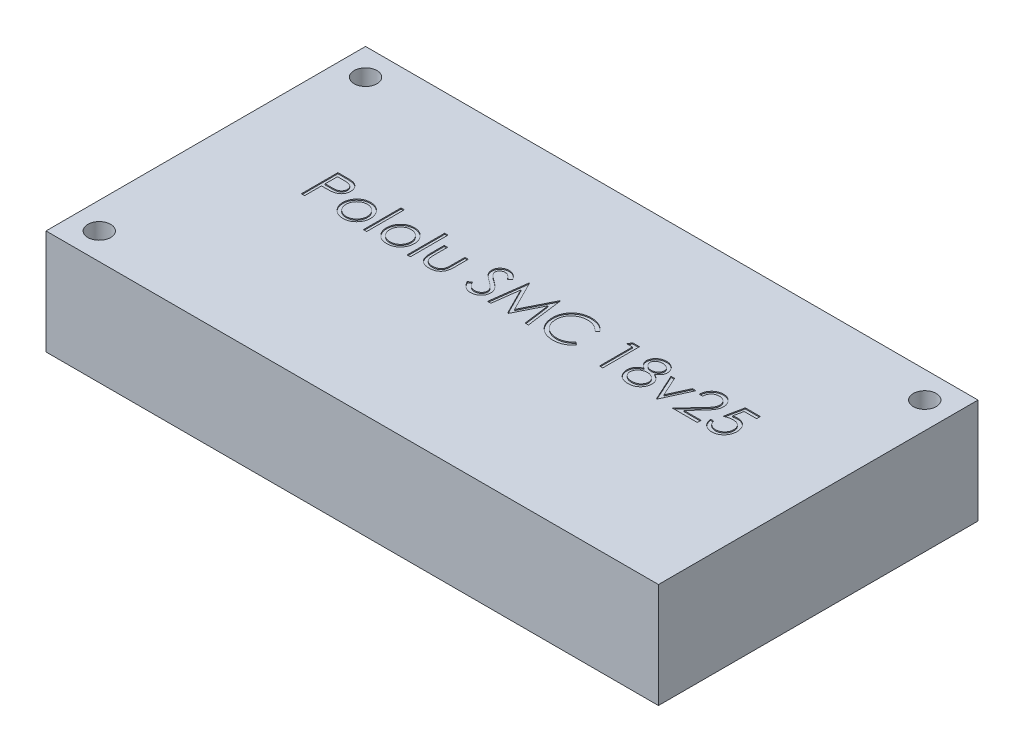
from build123d import *

# Parameters (mm, degrees)
SKETCH1_W           = 58.42
SKETCH1_H           = 30.48
BOSS_EXTRUDE1_DEPTH = 10
SKETCH2_R           = 1.0922
CUT_EXTRUDE1_DEPTH  = 35.430824852
SKETCH3_W           = 0.314102564
SKETCH3_H           = 3.58974359
CUT_EXTRUDE2_DEPTH  = 0.1


with BuildPart() as part:
    # Sketch1 → Boss-Extrude1 (new body)
    with BuildSketch(Plane(origin=(0, 0, 0), x_dir=(1, 0, 0), z_dir=(0, 1, 0))):
        Rectangle(SKETCH1_W, SKETCH1_H)
    extrude(amount=BOSS_EXTRUDE1_DEPTH)

    # Sketch2 → Cut-Extrude1 (cut, through all)
    with BuildSketch(Plane(origin=(0, 10, 0), x_dir=(1, 0, 0), z_dir=(0, 1, 0))):
        with Locations(Location((-26.67, 12.7, 0), (0, 0, 270))):
            Circle(SKETCH2_R)
        with Locations(Location((-26.67, -12.7, 0), (0, 0, 270))):
            Circle(SKETCH2_R)
        with Locations(Location((26.67, 12.7, 0), (0, 0, 270))):
            Circle(SKETCH2_R)
    extrude(amount=-CUT_EXTRUDE1_DEPTH, mode=Mode.SUBTRACT)

    # Sketch3 → Cut-Extrude2 (cut)
    # profile 1 of 14: a face of its own
    with BuildSketch(Plane(origin=(0, 10, 0), x_dir=(1, 0, 0), z_dir=(0, 1, 0))):
        with BuildLine():
            Line((-20.102564103, 3.5), (-19.416165865, 3.5))
            add(Edge.make_bspline(
                [(-19.416165865, 3.5), (-19.368954959, 3.499948104), (-19.278496766, 3.499848668), (-19.148781711, 3.496833922), (-19.030971979, 3.49280723), (-18.925321598, 3.487225337), (-18.8315055, 3.480628747), (-18.749948201, 3.471376708), (-18.680008644, 3.461716412), (-18.638102195, 3.451895005), (-18.618990385, 3.447415865)],
                knots=[0, 0, 0, 0, 1.415646017, 2.712440637, 3.8905458, 4.950247383, 5.884950622, 6.709939814, 7.411656543, 8, 8, 8, 8], degree=3))
            add(Edge.make_bspline(
                [(-18.618990385, 3.447415865), (-18.594796851, 3.440793916), (-18.546979874, 3.427706054), (-18.478078831, 3.40149233), (-18.412524985, 3.370410165), (-18.350093427, 3.334986225), (-18.291551344, 3.293700661), (-18.236025303, 3.248227043), (-18.184005322, 3.197515475), (-18.13578393, 3.142134735), (-18.091499133, 3.083014525), (-18.05336945, 3.019272295), (-18.021442223, 2.951980992), (-17.994058952, 2.881187421), (-17.974350497, 2.806297097), (-17.959503597, 2.727830385), (-17.95007997, 2.645795695), (-17.949177408, 2.589735827), (-17.948717949, 2.561197917)],
                knots=[0, 0, 0, 0, 0.999701418, 1.975846123, 2.934577507, 3.890451536, 4.834027766, 5.787354733, 6.749476667, 7.726910423, 8.712836071, 9.690891519, 10.682875813, 11.679750201, 12.712814741, 13.765529915, 14.8625177, 16, 16, 16, 16], degree=3))
            add(Edge.make_bspline(
                [(-17.948717949, 2.561197917), (-17.949139373, 2.53242014), (-17.949963919, 2.476114476), (-17.959860205, 2.393741688), (-17.973190396, 2.315023298), (-17.993687449, 2.240133847), (-18.020533122, 2.169518077), (-18.052025175, 2.102096845), (-18.090008705, 2.039017173), (-18.133653535, 1.980050055), (-18.182205129, 1.925140143), (-18.235458067, 1.874685348), (-18.29319736, 1.82898101), (-18.355239508, 1.787924666), (-18.422189357, 1.752468387), (-18.49303151, 1.720711082), (-18.568381727, 1.694040021), (-18.620524241, 1.68000996), (-18.647035256, 1.672876603)],
                knots=[0, 0, 0, 0, 1.121902311, 2.195077645, 3.232258892, 4.234102512, 5.217864754, 6.176164875, 7.132989551, 8.084763148, 9.034132444, 9.988522005, 10.94243251, 11.903244335, 12.886203696, 13.894208494, 14.929344452, 16, 16, 16, 16], degree=3))
            add(Edge.make_bspline(
                [(-18.647035256, 1.672876603), (-18.66896259, 1.668213621), (-18.717017618, 1.657994427), (-18.79616034, 1.64658597), (-18.888305726, 1.63684837), (-18.993328006, 1.629547232), (-19.111132911, 1.623296864), (-19.241784168, 1.61832877), (-19.385538245, 1.615598916), (-19.485809489, 1.615458123), (-19.538161058, 1.615384615)],
                knots=[0, 0, 0, 0, 0.601384939, 1.31797006, 2.144135048, 3.087295005, 4.142315834, 5.309527816, 6.595305764, 8, 8, 8, 8], degree=3))
            Line((-19.538161058, 1.615384615), (-19.788461538, 1.615384615))
            Line((-19.788461538, 1.615384615), (-19.788461538, 0))
            Line((-19.788461538, 0), (-20.102564103, 0))
            Line((-20.102564103, 0), (-20.102564103, 3.5))
        make_face()
        with BuildLine():
            Line((-19.788461538, 3.141025641), (-19.788461538, 1.974358974))
            Line((-19.788461538, 1.974358974), (-19.17568109, 1.966646635))
            add(Edge.make_bspline(
                [(-19.17568109, 1.966646635), (-19.145761164, 1.966631171), (-19.088001364, 1.966601319), (-19.004565141, 1.970586542), (-18.927155853, 1.975187075), (-18.856011278, 1.981922998), (-18.791099344, 1.991444256), (-18.732311815, 2.001055994), (-18.680104532, 2.014961356), (-18.61900533, 2.033684426), (-18.550921983, 2.065617041), (-18.476854434, 2.111966931), (-18.414083848, 2.17104764), (-18.359765551, 2.237475471), (-18.316659673, 2.3113746), (-18.285103681, 2.390443537), (-18.266562523, 2.473871387), (-18.26407633, 2.530959525), (-18.262820513, 2.559795673)],
                knots=[0, 0, 0, 0, 1.160613943, 2.240541288, 3.23993089, 4.169200891, 5.011653406, 5.7853311, 6.478053781, 7.106038997, 8.262395093, 9.384106736, 10.481365981, 11.59014053, 12.70357646, 13.786202915, 14.881775077, 16, 16, 16, 16], degree=3))
            add(Edge.make_bspline(
                [(-18.262820513, 2.559795673), (-18.264083159, 2.587934187), (-18.266593144, 2.643870069), (-18.285249007, 2.725848829), (-18.316598321, 2.804084534), (-18.360054916, 2.877057619), (-18.412796046, 2.943246423), (-18.474095389, 3.00074355), (-18.54380865, 3.046965253), (-18.608656881, 3.076798534), (-18.666258067, 3.09501381), (-18.716290027, 3.10775865), (-18.772780702, 3.117934257), (-18.835748481, 3.126173759), (-18.904705315, 3.133227221), (-18.98024363, 3.138013198), (-19.062077273, 3.140814654), (-19.118887844, 3.140953609), (-19.14833734, 3.141025641)],
                knots=[0, 0, 0, 0, 1.120700087, 2.227813068, 3.331159281, 4.466773991, 5.599788987, 6.693661531, 7.80175334, 8.91857717, 9.525282508, 10.207424825, 10.974604443, 11.810962634, 12.737642355, 13.736264703, 14.826523623, 16, 16, 16, 16], degree=3))
            Line((-19.14833734, 3.141025641), (-19.788461538, 3.141025641))
        make_face(mode=Mode.SUBTRACT)
    # profile 2 of 14: a face of its own
    with BuildSketch(Plane(origin=(0, 10, 0), x_dir=(1, 0, 0), z_dir=(0, 1, 0))):
        with BuildLine():
            add(Edge.make_bspline(
                [(-16.085136218, 2.602564103), (-16.037144945, 2.601542211), (-15.943045788, 2.599538533), (-15.805237902, 2.578123567), (-15.673692766, 2.545376203), (-15.547906574, 2.500104641), (-15.429490278, 2.43942269), (-15.316719034, 2.367013399), (-15.209902025, 2.281230805), (-15.145878996, 2.214872737), (-15.11338141, 2.181189904)],
                knots=[0, 0, 0, 0, 1.054011418, 2.066658804, 3.057071809, 4.030435133, 4.997543892, 5.974964718, 6.972108034, 8, 8, 8, 8], degree=3))
            add(Edge.make_bspline(
                [(-15.11338141, 2.181189904), (-15.085399456, 2.148975918), (-15.029977076, 2.085171376), (-14.958911357, 1.981715763), (-14.897689797, 1.874575662), (-14.848626836, 1.762328336), (-14.809941812, 1.645953664), (-14.782476116, 1.525051653), (-14.766139181, 1.399889306), (-14.763936214, 1.314885468), (-14.762820513, 1.271834936)],
                knots=[0, 0, 0, 0, 1.025258237, 2.030674902, 3.01204498, 3.988269485, 4.97094183, 5.956517959, 6.965070386, 8, 8, 8, 8], degree=3))
            add(Edge.make_bspline(
                [(-14.762820513, 1.271834936), (-14.76380185, 1.228534878), (-14.765741018, 1.142971945), (-14.784084635, 1.016952579), (-14.812615721, 0.894757756), (-14.853447559, 0.776899063), (-14.905805668, 0.663016235), (-14.969696356, 0.553606686), (-15.045567973, 0.448454553), (-15.13157197, 0.348452714), (-15.226623846, 0.2562865), (-15.329739994, 0.17595823), (-15.438894028, 0.107136706), (-15.555537381, 0.05170029), (-15.678604868, 0.00799059), (-15.808361936, -0.022709427), (-15.944607006, -0.04127111), (-16.037634228, -0.043654684), (-16.085136218, -0.044871795)],
                knots=[0, 0, 0, 0, 0.998656419, 1.973391657, 2.932242238, 3.890759089, 4.846373663, 5.82037756, 6.809684879, 7.83454468, 8.860553229, 9.859544525, 10.845671541, 11.83227036, 12.833544569, 13.85385346, 14.904124723, 16, 16, 16, 16], degree=3))
            add(Edge.make_bspline(
                [(-16.085136218, -0.044871795), (-16.132870937, -0.043650599), (-16.226361797, -0.041258824), (-16.363087779, -0.022781541), (-16.493077398, 0.007976441), (-16.616305997, 0.051843934), (-16.733450844, 0.107138478), (-16.84323734, 0.175750167), (-16.946437256, 0.256310322), (-17.04150924, 0.348446259), (-17.127507846, 0.448456216), (-17.203380854, 0.553606254), (-17.26727118, 0.663016348), (-17.319629384, 0.776899033), (-17.360461197, 0.894757764), (-17.38899229, 1.016952577), (-17.407335904, 1.142971945), (-17.409275073, 1.228534878), (-17.41025641, 1.271834936)],
                knots=[0, 0, 0, 0, 1.099876186, 2.154163076, 3.173186993, 4.173200201, 5.163417411, 6.152872554, 7.150605724, 8.17532212, 9.198891216, 10.186952605, 11.159729845, 12.11414092, 13.071450619, 14.029093627, 15.002601286, 16, 16, 16, 16], degree=3))
            add(Edge.make_bspline(
                [(-17.41025641, 1.271834936), (-17.4091331, 1.314651482), (-17.406909138, 1.399420884), (-17.390588629, 1.524347945), (-17.363230073, 1.645045334), (-17.324498676, 1.76097081), (-17.274983486, 1.872726246), (-17.214622198, 1.980131077), (-17.142831565, 2.083118877), (-17.087629614, 2.146840957), (-17.059695513, 2.179086538)],
                knots=[0, 0, 0, 0, 1.031353054, 2.041901799, 3.029428768, 4.008703097, 4.981709435, 5.96992636, 6.972712378, 8, 8, 8, 8], degree=3))
            add(Edge.make_bspline(
                [(-17.059695513, 2.179086538), (-17.027246922, 2.213061478), (-16.963431058, 2.279879174), (-16.85608233, 2.365411698), (-16.743588509, 2.439327772), (-16.623863583, 2.498803987), (-16.498180725, 2.545642505), (-16.365961482, 2.57820802), (-16.227685967, 2.599461375), (-16.133126346, 2.601519553), (-16.085136218, 2.602564103)],
                knots=[0, 0, 0, 0, 1.027980169, 2.021703884, 2.998553061, 3.971491411, 4.943284454, 5.930300938, 6.949603206, 8, 8, 8, 8], degree=3))
        make_face()
        with BuildLine():
            add(Edge.make_bspline(
                [(-16.086538462, 2.288461538), (-16.120476073, 2.287496947), (-16.187475202, 2.285592664), (-16.286094786, 2.27110876), (-16.38103494, 2.248161255), (-16.472475784, 2.215557199), (-16.560108957, 2.1734583), (-16.644018359, 2.12174994), (-16.724450799, 2.061116984), (-16.799832862, 1.991654312), (-16.869015175, 1.915775317), (-16.929493151, 1.834926959), (-16.980918258, 1.750420612), (-17.023758416, 1.662168401), (-17.055665605, 1.569275987), (-17.078838627, 1.472795356), (-17.093308867, 1.37252994), (-17.095195246, 1.304368921), (-17.096153846, 1.269731571)],
                knots=[0, 0, 0, 0, 1.021534396, 2.016698045, 2.994645724, 3.958388632, 4.93408049, 5.916473867, 6.921342795, 7.962252576, 8.998418191, 10.008913653, 10.997312074, 11.973003931, 12.956656626, 13.948281152, 14.957379055, 16, 16, 16, 16], degree=3))
            add(Edge.make_bspline(
                [(-17.096153846, 1.269731571), (-17.094547023, 1.224979543), (-17.091357778, 1.136155138), (-17.065422542, 1.005344015), (-17.022036262, 0.879762163), (-16.963448982, 0.760145777), (-16.890042763, 0.649473499), (-16.803555697, 0.550802015), (-16.704915996, 0.465616203), (-16.595299496, 0.394935358), (-16.476945178, 0.338775602), (-16.351688857, 0.298976626), (-16.221048163, 0.273104934), (-16.131767432, 0.270533459), (-16.086538462, 0.269230769)],
                knots=[0, 0, 0, 0, 1.016792936, 2.018143844, 3.017858371, 4.030088057, 5.03801393, 6.028138512, 7.003788237, 7.991172063, 8.984598303, 9.972568034, 10.972917682, 12, 12, 12, 12], degree=3))
            add(Edge.make_bspline(
                [(-16.086538462, 0.269230769), (-16.041312093, 0.270541049), (-15.952036497, 0.273127506), (-15.82157732, 0.298846326), (-15.696663348, 0.338949987), (-15.57843196, 0.394872197), (-15.468865357, 0.465884611), (-15.369516236, 0.550320988), (-15.283767625, 0.64973484), (-15.21043402, 0.760292369), (-15.150887277, 0.879576721), (-15.107704075, 1.005367193), (-15.081706489, 1.136149235), (-15.078525661, 1.224977566), (-15.076923077, 1.269731571)],
                knots=[0, 0, 0, 0, 1.02726834, 2.027799167, 3.010890988, 4.004497153, 4.992059811, 5.971914811, 6.958719428, 7.966827853, 8.981595046, 9.981490638, 10.983022906, 12, 12, 12, 12], degree=3))
            add(Edge.make_bspline(
                [(-15.076923077, 1.269731571), (-15.077881347, 1.304369128), (-15.079767076, 1.372530554), (-15.09424204, 1.472793007), (-15.11739758, 1.569284604), (-15.149369197, 1.662136607), (-15.192023211, 1.750649112), (-15.244440004, 1.834678839), (-15.30467103, 1.916055385), (-15.374688151, 1.991409026), (-15.449991528, 2.061144062), (-15.530456567, 2.121773452), (-15.614241545, 2.173231047), (-15.701620128, 2.215917288), (-15.793072696, 2.247864628), (-15.887879825, 2.271241259), (-15.986078635, 2.285531456), (-16.052837678, 2.287478598), (-16.086538462, 2.288461538)],
                knots=[0, 0, 0, 0, 1.042956736, 2.052379634, 3.044323526, 4.02829302, 5.004299113, 5.996692471, 7.007513377, 8.048758398, 9.090003419, 10.095195979, 11.07790575, 12.047570684, 13.018257071, 13.989683339, 14.985167495, 16, 16, 16, 16], degree=3))
        make_face(mode=Mode.SUBTRACT)
    # profile 3 of 14: a face of its own
    with BuildSketch(Plane(origin=(0, 10, 0), x_dir=(1, 0, 0), z_dir=(0, 1, 0))):
        with Locations((-14.022435897, 1.794871795)):
            Rectangle(SKETCH3_W, SKETCH3_H)
    # profile 4 of 14: a face of its own
    with BuildSketch(Plane(origin=(0, 10, 0), x_dir=(1, 0, 0), z_dir=(0, 1, 0))):
        with BuildLine():
            add(Edge.make_bspline(
                [(-11.912059295, 2.602564103), (-11.864068022, 2.601542211), (-11.769968864, 2.599538533), (-11.632160979, 2.578123567), (-11.500615843, 2.545376203), (-11.37482965, 2.500104641), (-11.256413355, 2.43942269), (-11.143642111, 2.367013399), (-11.036825102, 2.281230805), (-10.972802073, 2.214872737), (-10.940304487, 2.181189904)],
                knots=[0, 0, 0, 0, 1.054011418, 2.066658804, 3.057071809, 4.030435133, 4.997543892, 5.974964718, 6.972108034, 8, 8, 8, 8], degree=3))
            add(Edge.make_bspline(
                [(-10.940304487, 2.181189904), (-10.912322533, 2.148975918), (-10.856900153, 2.085171376), (-10.785834434, 1.981715763), (-10.724612874, 1.874575662), (-10.675549913, 1.762328336), (-10.636864889, 1.645953664), (-10.609399193, 1.525051653), (-10.593062258, 1.399889306), (-10.590859291, 1.314885468), (-10.58974359, 1.271834936)],
                knots=[0, 0, 0, 0, 1.025258237, 2.030674902, 3.01204498, 3.988269485, 4.97094183, 5.956517959, 6.965070386, 8, 8, 8, 8], degree=3))
            add(Edge.make_bspline(
                [(-10.58974359, 1.271834936), (-10.590724927, 1.228534878), (-10.592664095, 1.142971945), (-10.611007712, 1.016952579), (-10.639538798, 0.894757756), (-10.680370636, 0.776899063), (-10.732728745, 0.663016235), (-10.796619433, 0.553606686), (-10.87249105, 0.448454553), (-10.958495047, 0.348452714), (-11.053546923, 0.2562865), (-11.156663071, 0.17595823), (-11.265817105, 0.107136706), (-11.382460458, 0.05170029), (-11.505527945, 0.00799059), (-11.635285013, -0.022709427), (-11.771530083, -0.04127111), (-11.864557305, -0.043654684), (-11.912059295, -0.044871795)],
                knots=[0, 0, 0, 0, 0.998656419, 1.973391657, 2.932242238, 3.890759089, 4.846373663, 5.82037756, 6.809684879, 7.83454468, 8.860553229, 9.859544525, 10.845671541, 11.83227036, 12.833544569, 13.85385346, 14.904124723, 16, 16, 16, 16], degree=3))
            add(Edge.make_bspline(
                [(-11.912059295, -0.044871795), (-11.959794014, -0.043650599), (-12.053284874, -0.041258824), (-12.190010856, -0.022781541), (-12.320000475, 0.007976441), (-12.443229073, 0.051843934), (-12.56037392, 0.107138478), (-12.670160417, 0.175750167), (-12.773360333, 0.256310322), (-12.868432317, 0.348446259), (-12.954430923, 0.448456216), (-13.030303931, 0.553606254), (-13.094194257, 0.663016348), (-13.146552461, 0.776899033), (-13.187384274, 0.894757764), (-13.215915367, 1.016952577), (-13.234258981, 1.142971945), (-13.23619815, 1.228534878), (-13.237179487, 1.271834936)],
                knots=[0, 0, 0, 0, 1.099876186, 2.154163076, 3.173186993, 4.173200201, 5.163417411, 6.152872554, 7.150605724, 8.17532212, 9.198891216, 10.186952605, 11.159729845, 12.11414092, 13.071450619, 14.029093627, 15.002601286, 16, 16, 16, 16], degree=3))
            add(Edge.make_bspline(
                [(-13.237179487, 1.271834936), (-13.236056177, 1.314651482), (-13.233832215, 1.399420884), (-13.217511706, 1.524347945), (-13.19015315, 1.645045334), (-13.151421753, 1.76097081), (-13.101906562, 1.872726246), (-13.041545275, 1.980131077), (-12.969754642, 2.083118877), (-12.91455269, 2.146840957), (-12.88661859, 2.179086538)],
                knots=[0, 0, 0, 0, 1.031353054, 2.041901799, 3.029428768, 4.008703097, 4.981709435, 5.96992636, 6.972712378, 8, 8, 8, 8], degree=3))
            add(Edge.make_bspline(
                [(-12.88661859, 2.179086538), (-12.854169999, 2.213061478), (-12.790354135, 2.279879174), (-12.683005407, 2.365411698), (-12.570511586, 2.439327772), (-12.45078666, 2.498803987), (-12.325103802, 2.545642505), (-12.192884559, 2.57820802), (-12.054609044, 2.599461375), (-11.960049423, 2.601519553), (-11.912059295, 2.602564103)],
                knots=[0, 0, 0, 0, 1.027980169, 2.021703884, 2.998553061, 3.971491411, 4.943284454, 5.930300938, 6.949603206, 8, 8, 8, 8], degree=3))
        make_face()
        with BuildLine():
            add(Edge.make_bspline(
                [(-11.913461538, 2.288461538), (-11.94739915, 2.287496947), (-12.014398278, 2.285592664), (-12.113017863, 2.27110876), (-12.207958017, 2.248161255), (-12.299398861, 2.215557199), (-12.387032034, 2.1734583), (-12.470941436, 2.12174994), (-12.551373876, 2.061116984), (-12.626755939, 1.991654312), (-12.695938251, 1.915775317), (-12.756416228, 1.834926959), (-12.807841334, 1.750420612), (-12.850681493, 1.662168401), (-12.882588681, 1.569275987), (-12.905761704, 1.472795356), (-12.920231944, 1.37252994), (-12.922118323, 1.304368921), (-12.923076923, 1.269731571)],
                knots=[0, 0, 0, 0, 1.021534396, 2.016698045, 2.994645724, 3.958388632, 4.93408049, 5.916473867, 6.921342795, 7.962252576, 8.998418191, 10.008913653, 10.997312074, 11.973003931, 12.956656626, 13.948281152, 14.957379055, 16, 16, 16, 16], degree=3))
            add(Edge.make_bspline(
                [(-12.923076923, 1.269731571), (-12.921470099, 1.224979543), (-12.918280855, 1.136155138), (-12.892345619, 1.005344015), (-12.848959339, 0.879762163), (-12.790372059, 0.760145777), (-12.71696584, 0.649473499), (-12.630478774, 0.550802015), (-12.531839073, 0.465616203), (-12.422222573, 0.394935358), (-12.303868255, 0.338775602), (-12.178611934, 0.298976626), (-12.04797124, 0.273104934), (-11.958690509, 0.270533459), (-11.913461538, 0.269230769)],
                knots=[0, 0, 0, 0, 1.016792936, 2.018143844, 3.017858371, 4.030088057, 5.03801393, 6.028138512, 7.003788237, 7.991172063, 8.984598303, 9.972568034, 10.972917682, 12, 12, 12, 12], degree=3))
            add(Edge.make_bspline(
                [(-11.913461538, 0.269230769), (-11.86823517, 0.270541049), (-11.778959574, 0.273127506), (-11.648500397, 0.298846326), (-11.523586425, 0.338949987), (-11.405355037, 0.394872197), (-11.295788434, 0.465884611), (-11.196439313, 0.550320988), (-11.110690701, 0.64973484), (-11.037357097, 0.760292369), (-10.977810354, 0.879576721), (-10.934627152, 1.005367193), (-10.908629566, 1.136149235), (-10.905448737, 1.224977566), (-10.903846154, 1.269731571)],
                knots=[0, 0, 0, 0, 1.02726834, 2.027799167, 3.010890988, 4.004497153, 4.992059811, 5.971914811, 6.958719428, 7.966827853, 8.981595046, 9.981490638, 10.983022906, 12, 12, 12, 12], degree=3))
            add(Edge.make_bspline(
                [(-10.903846154, 1.269731571), (-10.904804424, 1.304369128), (-10.906690153, 1.372530554), (-10.921165117, 1.472793007), (-10.944320657, 1.569284604), (-10.976292274, 1.662136607), (-11.018946288, 1.750649112), (-11.071363081, 1.834678839), (-11.131594107, 1.916055385), (-11.201611228, 1.991409026), (-11.276914605, 2.061144062), (-11.357379644, 2.121773452), (-11.441164622, 2.173231047), (-11.528543205, 2.215917288), (-11.619995772, 2.247864628), (-11.714802902, 2.271241259), (-11.813001712, 2.285531456), (-11.879760755, 2.287478598), (-11.913461538, 2.288461538)],
                knots=[0, 0, 0, 0, 1.042956736, 2.052379634, 3.044323526, 4.02829302, 5.004299113, 5.996692471, 7.007513377, 8.048758398, 9.090003419, 10.095195979, 11.07790575, 12.047570684, 13.018257071, 13.989683339, 14.985167495, 16, 16, 16, 16], degree=3))
        make_face(mode=Mode.SUBTRACT)
    # profile 5 of 14: a face of its own
    with BuildSketch(Plane(origin=(0, 10, 0), x_dir=(1, 0, 0), z_dir=(0, 1, 0))):
        with Locations((-9.849358974, 1.794871795)):
            Rectangle(SKETCH3_W, SKETCH3_H)
    # profile 6 of 14: a face of its own
    with BuildSketch(Plane(origin=(0, 10, 0), x_dir=(1, 0, 0), z_dir=(0, 1, 0))):
        with BuildLine():
            Line((-9.019230769, 2.557692308), (-8.705128205, 2.557692308))
            Line((-8.705128205, 2.557692308), (-8.705128205, 1.371394231))
            add(Edge.make_bspline(
                [(-8.705128205, 1.371394231), (-8.7049863, 1.336571482), (-8.704714843, 1.269957194), (-8.702873902, 1.174102007), (-8.698543808, 1.086685294), (-8.693129984, 1.007656557), (-8.686167848, 0.937029166), (-8.677884487, 0.875049809), (-8.668626065, 0.821015625), (-8.659563352, 0.788472269), (-8.655348558, 0.77333734)],
                knots=[0, 0, 0, 0, 1.388932606, 2.656963016, 3.823490214, 4.879454478, 5.816252168, 6.653371382, 7.373723809, 8, 8, 8, 8], degree=3))
            add(Edge.make_bspline(
                [(-8.655348558, 0.77333734), (-8.648587103, 0.754314469), (-8.635204762, 0.716664208), (-8.610931278, 0.662275202), (-8.580902941, 0.61189992), (-8.548043113, 0.563595847), (-8.510143706, 0.51879386), (-8.467684235, 0.477569617), (-8.422085998, 0.438365526), (-8.354330974, 0.391980734), (-8.261671708, 0.342265403), (-8.140018953, 0.299369585), (-8.008114727, 0.273733765), (-7.916950008, 0.27075951), (-7.870092147, 0.269230769)],
                knots=[0, 0, 0, 0, 0.725840625, 1.436591201, 2.137033971, 2.831655856, 3.53531722, 4.242432219, 4.957935707, 5.694543706, 7.190802206, 8.724350549, 10.316345118, 12, 12, 12, 12], degree=3))
            add(Edge.make_bspline(
                [(-7.870092147, 0.269230769), (-7.82323864, 0.270792018), (-7.732585771, 0.273812745), (-7.602130802, 0.298596284), (-7.482879388, 0.340001973), (-7.376028436, 0.397809384), (-7.282062596, 0.468551447), (-7.203758177, 0.551560256), (-7.139150923, 0.644209643), (-7.110941502, 0.713333922), (-7.096754808, 0.748096955)],
                knots=[0, 0, 0, 0, 1.157059328, 2.238695713, 3.266970494, 4.264342957, 5.228770407, 6.160125903, 7.074715775, 8, 8, 8, 8], degree=3))
            add(Edge.make_bspline(
                [(-7.096754808, 0.748096955), (-7.092560578, 0.762063254), (-7.083288159, 0.792939329), (-7.073325808, 0.845319078), (-7.064351346, 0.907783682), (-7.05668817, 0.980741891), (-7.051223007, 1.064003043), (-7.048276981, 1.157541119), (-7.044948706, 1.26106248), (-7.044898189, 1.333530239), (-7.044871795, 1.371394231)],
                knots=[0, 0, 0, 0, 0.557542046, 1.232589297, 2.036731608, 2.971723315, 4.038036528, 5.22795436, 6.551621927, 8, 8, 8, 8], degree=3))
            Line((-7.044871795, 1.371394231), (-7.044871795, 2.557692308))
            Line((-7.044871795, 2.557692308), (-6.730769231, 2.557692308))
            Line((-6.730769231, 2.557692308), (-6.730769231, 1.3125))
            add(Edge.make_bspline(
                [(-6.730769231, 1.3125), (-6.731210926, 1.270192829), (-6.732067874, 1.188111129), (-6.737575217, 1.068827017), (-6.74702483, 0.957664772), (-6.761367515, 0.854565552), (-6.77823319, 0.759608071), (-6.799989463, 0.672670625), (-6.8259677, 0.594021071), (-6.855273215, 0.522279294), (-6.889895083, 0.4572324), (-6.926722103, 0.395496583), (-6.969246875, 0.338603648), (-7.01401711, 0.283721511), (-7.063818765, 0.233579983), (-7.117718624, 0.187028507), (-7.174958044, 0.143355476), (-7.236807242, 0.104264196), (-7.302363305, 0.069047551), (-7.371707162, 0.037831473), (-7.44568816, 0.013128896), (-7.523351797, -0.00818177), (-7.605078577, -0.024896239), (-7.69078971, -0.036682806), (-7.780456326, -0.043908137), (-7.841565786, -0.044545182), (-7.872896635, -0.044871795)],
                knots=[0, 0, 0, 0, 1.493040784, 2.896703357, 4.213163133, 5.428574705, 6.569057535, 7.615249723, 8.588095153, 9.490268104, 10.346124644, 11.18633936, 12.024365274, 12.850166724, 13.684164916, 14.514361689, 15.362232829, 16.222528818, 17.093394965, 17.986930858, 18.902426812, 19.842810585, 20.827885679, 21.843828298, 22.894529745, 24, 24, 24, 24], degree=3))
            add(Edge.make_bspline(
                [(-7.872896635, -0.044871795), (-7.903993149, -0.044532088), (-7.965100694, -0.043864532), (-8.054771938, -0.036722724), (-8.140720544, -0.024914553), (-8.222640943, -0.008059336), (-8.30061534, 0.012979734), (-8.37495958, 0.03798327), (-8.444803143, 0.069063751), (-8.510985147, 0.104041309), (-8.572987535, 0.143606584), (-8.631096113, 0.186974624), (-8.685232966, 0.234080687), (-8.735410034, 0.284728044), (-8.78092301, 0.33954498), (-8.822339052, 0.398090541), (-8.860295757, 0.459784629), (-8.894648548, 0.525847792), (-8.924160303, 0.598419802), (-8.950215549, 0.678716899), (-8.971526188, 0.767619415), (-8.988868656, 0.865051344), (-9.002820096, 0.970546385), (-9.012506239, 1.084714801), (-9.017922069, 1.207278493), (-9.018785131, 1.291928383), (-9.019230769, 1.335637019)],
                knots=[0, 0, 0, 0, 1.083640291, 2.129454052, 3.13281866, 4.105697902, 5.042300162, 5.946461698, 6.836384745, 7.703652036, 8.553297018, 9.397182691, 10.228592656, 11.052265423, 11.879314572, 12.708807002, 13.549817954, 14.402308542, 15.300838682, 16.27712199, 17.341985831, 18.484375296, 19.725102775, 21.0496083, 22.476576903, 24, 24, 24, 24], degree=3))
            Line((-9.019230769, 1.335637019), (-9.019230769, 2.557692308))
        make_face()
    # profile 7 of 14: a face of its own
    with BuildSketch(Plane(origin=(0, 10, 0), x_dir=(1, 0, 0), z_dir=(0, 1, 0))):
        with BuildLine():
            Line((-4.935897436, 0.675180288), (-4.640024038, 0.852564103))
            add(Edge.make_bspline(
                [(-4.640024038, 0.852564103), (-4.612505801, 0.806499718), (-4.559781921, 0.718242134), (-4.471830561, 0.598984093), (-4.38069765, 0.497621937), (-4.285708317, 0.414745329), (-4.187442369, 0.349496442), (-4.085258315, 0.303294211), (-3.979500504, 0.274478235), (-3.907526683, 0.270978149), (-3.871594551, 0.269230769)],
                knots=[0, 0, 0, 0, 1.272034388, 2.437168799, 3.508375237, 4.49857839, 5.41946034, 6.295179144, 7.148887113, 8, 8, 8, 8], degree=3))
            add(Edge.make_bspline(
                [(-3.871594551, 0.269230769), (-3.840907691, 0.270085442), (-3.780070918, 0.271779832), (-3.690508675, 0.288060634), (-3.603526872, 0.313072763), (-3.520918235, 0.348893694), (-3.44382262, 0.39223218), (-3.376215925, 0.444578358), (-3.317769812, 0.503184563), (-3.269960697, 0.568567218), (-3.233280662, 0.638884367), (-3.205088593, 0.711060318), (-3.18944352, 0.786228886), (-3.187086766, 0.836839349), (-3.185897436, 0.862379808)],
                knots=[0, 0, 0, 0, 1.095163259, 2.171163733, 3.241058638, 4.321873601, 5.38011039, 6.391990106, 7.366004449, 8.327778327, 9.272591725, 10.192022065, 11.087607919, 12, 12, 12, 12], degree=3))
            add(Edge.make_bspline(
                [(-3.185897436, 0.862379808), (-3.187371747, 0.891520657), (-3.190368805, 0.950759747), (-3.215700285, 1.0381594), (-3.255549532, 1.12465197), (-3.292312175, 1.178153235), (-3.311398237, 1.205929487)],
                knots=[0, 0, 0, 0, 0.938893495, 1.908633276, 2.914225137, 4, 4, 4, 4], degree=3))
            add(Edge.make_bspline(
                [(-3.311398237, 1.205929487), (-3.327068851, 1.225976311), (-3.359967346, 1.268062109), (-3.416524858, 1.330707345), (-3.482890973, 1.395325764), (-3.556794527, 1.464384821), (-3.640927616, 1.534672617), (-3.732655131, 1.609540895), (-3.83431899, 1.686142472), (-3.905618486, 1.737515038), (-3.942407853, 1.764022436)],
                knots=[0, 0, 0, 0, 0.722233717, 1.516239348, 2.393582979, 3.351407094, 4.387010283, 5.505090956, 6.712668013, 8, 8, 8, 8], degree=3))
            add(Edge.make_bspline(
                [(-3.942407853, 1.764022436), (-3.979231849, 1.790251024), (-4.049636525, 1.840398086), (-4.148095108, 1.91482237), (-4.236139571, 1.982866239), (-4.313378587, 2.045170251), (-4.379778184, 2.101742856), (-4.435861595, 2.152040795), (-4.480200152, 2.197424356), (-4.504855733, 2.226865698), (-4.515925481, 2.240084135)],
                knots=[0, 0, 0, 0, 1.452282411, 2.77665338, 3.964542531, 5.026858415, 5.96415736, 6.766646006, 7.446254459, 8, 8, 8, 8], degree=3))
            add(Edge.make_bspline(
                [(-4.515925481, 2.240084135), (-4.531398026, 2.260685171), (-4.561826863, 2.301199875), (-4.601992868, 2.364524733), (-4.636132031, 2.429347998), (-4.662894363, 2.495843863), (-4.685430582, 2.563078792), (-4.700588513, 2.631930038), (-4.71007991, 2.702088656), (-4.711051896, 2.749302157), (-4.711538462, 2.772936699)],
                knots=[0, 0, 0, 0, 1.068054152, 2.10047183, 3.106115577, 4.101338837, 5.06977816, 6.043150881, 7.020423561, 8, 8, 8, 8], degree=3))
            add(Edge.make_bspline(
                [(-4.711538462, 2.772936699), (-4.710233253, 2.809966473), (-4.707650732, 2.883234537), (-4.685810215, 2.990265367), (-4.651337322, 3.092451785), (-4.603042434, 3.188782118), (-4.540785081, 3.276748099), (-4.468739106, 3.357361586), (-4.38292762, 3.425130168), (-4.288774997, 3.484342227), (-4.185718625, 3.530688152), (-4.077727721, 3.565649132), (-3.964630649, 3.58545839), (-3.888027515, 3.588301155), (-3.849158654, 3.58974359)],
                knots=[0, 0, 0, 0, 1.005424448, 1.989358655, 2.955360095, 3.929531133, 4.905563448, 5.876582895, 6.856512386, 7.866279853, 8.892233794, 9.918561126, 10.94386622, 12, 12, 12, 12], degree=3))
            add(Edge.make_bspline(
                [(-3.849158654, 3.58974359), (-3.807914554, 3.588321038), (-3.725893202, 3.585492037), (-3.605243986, 3.560894506), (-3.48908327, 3.520193834), (-3.395640005, 3.474005176), (-3.322507244, 3.42787376), (-3.266734511, 3.385853936), (-3.21021706, 3.337478827), (-3.152499005, 3.282619581), (-3.094558346, 3.22077283), (-3.035534894, 3.152362141), (-2.975290625, 3.077805585), (-2.936534765, 3.024581085), (-2.916666667, 2.997295673)],
                knots=[0, 0, 0, 0, 1.286793592, 2.559021753, 3.825965368, 5.121522368, 5.803751409, 6.523245864, 7.299691795, 8.125521123, 9.008227632, 9.944561021, 10.946284179, 12, 12, 12, 12], degree=3))
            Line((-2.916666667, 2.997295673), (-3.200620994, 2.782051282))
            add(Edge.make_bspline(
                [(-3.200620994, 2.782051282), (-3.217766926, 2.804139972), (-3.250785983, 2.846677626), (-3.30091547, 2.906248941), (-3.348164118, 2.960665421), (-3.394714518, 3.007930549), (-3.438108149, 3.050632682), (-3.480225191, 3.087192439), (-3.520459543, 3.117968034), (-3.571176453, 3.150811594), (-3.634894172, 3.183368098), (-3.714878708, 3.210917176), (-3.798464983, 3.227472238), (-3.855394614, 3.229661126), (-3.884214744, 3.230769231)],
                knots=[0, 0, 0, 0, 1.181633172, 2.275549214, 3.290209073, 4.226197932, 5.078386478, 5.862611352, 6.581680152, 7.217281963, 8.414376989, 9.595101626, 10.782541182, 12, 12, 12, 12], degree=3))
            add(Edge.make_bspline(
                [(-3.884214744, 3.230769231), (-3.920371266, 3.229557531), (-3.990095713, 3.227220882), (-4.08908595, 3.201700896), (-4.178179875, 3.161519036), (-4.25473244, 3.105204058), (-4.318469417, 3.038483065), (-4.364574875, 2.96170421), (-4.39232504, 2.876921808), (-4.39571132, 2.817780151), (-4.397435897, 2.787660256)],
                knots=[0, 0, 0, 0, 1.14458467, 2.207223713, 3.21896685, 4.227309161, 5.202851033, 6.127160689, 7.046193047, 8, 8, 8, 8], degree=3))
            add(Edge.make_bspline(
                [(-4.397435897, 2.787660256), (-4.397042771, 2.768908778), (-4.396255875, 2.731375158), (-4.385281077, 2.675923736), (-4.371181748, 2.620612397), (-4.348839116, 2.565689814), (-4.317993813, 2.510195455), (-4.277488637, 2.453173718), (-4.226475325, 2.394122009), (-4.187398312, 2.355714635), (-4.166766827, 2.335436699)],
                knots=[0, 0, 0, 0, 0.858281714, 1.717966888, 2.583508476, 3.4729293, 4.427298488, 5.488583878, 6.674047936, 8, 8, 8, 8], degree=3))
            add(Edge.make_bspline(
                [(-4.166766827, 2.335436699), (-4.159105455, 2.328599673), (-4.140903787, 2.312356465), (-4.107627862, 2.285764184), (-4.063685063, 2.252961412), (-4.010222862, 2.212374095), (-3.946255501, 2.165292633), (-3.871775944, 2.112319021), (-3.787614412, 2.051733562), (-3.727892496, 2.009376021), (-3.696314103, 1.986979167)],
                knots=[0, 0, 0, 0, 0.420754252, 0.999615792, 1.744751191, 2.668019286, 3.750313428, 4.999500688, 6.413464383, 8, 8, 8, 8], degree=3))
            add(Edge.make_bspline(
                [(-3.696314103, 1.986979167), (-3.658328189, 1.959337807), (-3.584773733, 1.905814145), (-3.480116153, 1.825398465), (-3.385222345, 1.746750697), (-3.299759141, 1.67037309), (-3.222882233, 1.596844997), (-3.155444512, 1.525281816), (-3.096758832, 1.456196244), (-3.033579613, 1.367623668), (-2.969021794, 1.258842584), (-2.913580286, 1.125564345), (-2.878621939, 0.991768025), (-2.874050424, 0.901841188), (-2.871794872, 0.857471955)],
                knots=[0, 0, 0, 0, 1.163667725, 2.253281268, 3.268753668, 4.215851969, 5.092017293, 5.902905408, 6.650798638, 7.335211899, 8.59617414, 9.77448103, 10.901945474, 12, 12, 12, 12], degree=3))
            add(Edge.make_bspline(
                [(-2.871794872, 0.857471955), (-2.87245201, 0.82609359), (-2.873753525, 0.763946206), (-2.888714439, 0.67269113), (-2.910634104, 0.58406026), (-2.943671338, 0.499149147), (-2.983994496, 0.416404385), (-3.035160744, 0.337996484), (-3.094468429, 0.262190086), (-3.162502194, 0.191006594), (-3.236948096, 0.125660398), (-3.315631791, 0.067531337), (-3.398682064, 0.019063014), (-3.48564838, -0.020487828), (-3.576550717, -0.051421346), (-3.671358501, -0.073834215), (-3.770228012, -0.087589926), (-3.837428494, -0.089017687), (-3.871594551, -0.08974359)],
                knots=[0, 0, 0, 0, 0.983748083, 1.948392443, 2.894712957, 3.844097841, 4.80183111, 5.778335162, 6.776009319, 7.81870978, 8.863265674, 9.881300176, 10.883814829, 11.87499822, 12.874611388, 13.892143829, 14.928324115, 16, 16, 16, 16], degree=3))
            add(Edge.make_bspline(
                [(-3.871594551, -0.08974359), (-3.898029894, -0.089232408), (-3.950567654, -0.088216483), (-4.028277136, -0.079235202), (-4.104416725, -0.066528099), (-4.178031007, -0.046354029), (-4.250068419, -0.021877052), (-4.320215654, 0.008261281), (-4.388506707, 0.044378482), (-4.45532429, 0.085673507), (-4.520498465, 0.133731252), (-4.583417933, 0.189704748), (-4.646147118, 0.252050253), (-4.706834515, 0.322460816), (-4.766707659, 0.399798899), (-4.824586069, 0.484788083), (-4.881667786, 0.576965436), (-4.917483254, 0.641830522), (-4.935897436, 0.675180288)],
                knots=[0, 0, 0, 0, 0.915332311, 1.819136955, 2.706846663, 3.586547465, 4.459518054, 5.340707479, 6.227863349, 7.133153174, 8.059268498, 9.028702269, 10.047606654, 11.120612155, 12.245963614, 13.433783089, 14.680604001, 16, 16, 16, 16], degree=3))
        make_face()
    # profile 8 of 14: a face of its own
    with BuildSketch(Plane(origin=(0, 10, 0), x_dir=(1, 0, 0), z_dir=(0, 1, 0))):
        Polygon((-2.333333333, 0), (-1.871294071, 3.5), (-1.826422276, 3.5), (-0.381410256, 0.628205128), (1.060096154, 3.5), (1.105669071, 3.5), (1.570512821, 0), (1.255008013, 0), (0.919871795, 2.518429487), (-0.343549679, 0), (-0.414362981, 0), (-1.682692308, 2.524038462), (-2.017127404, 0), align=None)
    # profile 9 of 14: a face of its own
    with BuildSketch(Plane(origin=(0, 10, 0), x_dir=(1, 0, 0), z_dir=(0, 1, 0))):
        with BuildLine():
            Line((5.519230769, 2.857772436), (5.244391026, 2.647435897))
            add(Edge.make_bspline(
                [(5.244391026, 2.647435897), (5.224785137, 2.670801867), (5.18583769, 2.717218783), (5.123178488, 2.782398327), (5.057876845, 2.843463589), (4.989957724, 2.900705469), (4.918198604, 2.952122234), (4.844337806, 3.000393337), (4.76713976, 3.043661075), (4.660388026, 3.096124061), (4.520740178, 3.150870216), (4.344945338, 3.196773448), (4.16143424, 3.225994623), (4.03623664, 3.229159465), (3.97255609, 3.230769231)],
                knots=[0, 0, 0, 0, 0.757959112, 1.505699292, 2.245454638, 2.979532153, 3.711538275, 4.438200793, 5.171680507, 5.909471876, 7.393775596, 8.890124382, 10.418191784, 12, 12, 12, 12], degree=3))
            add(Edge.make_bspline(
                [(3.97255609, 3.230769231), (3.93747279, 3.230365268), (3.867631798, 3.229561092), (3.763983324, 3.218951967), (3.662270273, 3.204040757), (3.562558807, 3.181915434), (3.464975848, 3.153942815), (3.368883446, 3.120517401), (3.275672847, 3.079162561), (3.184054608, 3.033454301), (3.096275397, 2.981826856), (3.01322035, 2.925513504), (2.935192382, 2.865144408), (2.86212977, 2.800493302), (2.793957821, 2.731851341), (2.73117051, 2.658487), (2.6739851, 2.580634826), (2.621268075, 2.499321419), (2.574055342, 2.414783627), (2.534525462, 2.326708556), (2.49952034, 2.236604453), (2.471821097, 2.143453293), (2.449896581, 2.047910527), (2.434768917, 1.949719739), (2.424280446, 1.849086059), (2.423480269, 1.780876747), (2.423076923, 1.746494391)],
                knots=[0, 0, 0, 0, 1.054917814, 2.100044995, 3.131103042, 4.146048494, 5.169673617, 6.183595914, 7.203665975, 8.234915748, 9.262203917, 10.264457458, 11.251630812, 12.227803204, 13.197192746, 14.159520551, 15.12972552, 16.100847026, 17.073214652, 18.039054194, 19.002613845, 19.979014051, 20.95965708, 21.949030935, 22.966165397, 24, 24, 24, 24], degree=3))
            add(Edge.make_bspline(
                [(2.423076923, 1.746494391), (2.424338742, 1.694763071), (2.426816156, 1.593195486), (2.44886449, 1.444424876), (2.482369582, 1.301904202), (2.532585159, 1.16652436), (2.594504209, 1.036616002), (2.672744821, 0.914377148), (2.763361358, 0.797960584), (2.867635778, 0.690117636), (2.982041594, 0.591603911), (3.104789505, 0.504853329), (3.235573793, 0.432538447), (3.372950423, 0.3723625), (3.517976537, 0.326105772), (3.670391339, 0.293541649), (3.829863335, 0.272299468), (3.938832735, 0.27026578), (3.994290865, 0.269230769)],
                knots=[0, 0, 0, 0, 1.029171465, 2.020641659, 2.987623507, 3.938342917, 4.889210282, 5.84687017, 6.821220943, 7.821438502, 8.827599549, 9.822697543, 10.807740252, 11.797342354, 12.80366471, 13.83203677, 14.896651826, 16, 16, 16, 16], degree=3))
            add(Edge.make_bspline(
                [(3.994290865, 0.269230769), (4.055393554, 0.270919549), (4.175658263, 0.274243472), (4.35202629, 0.302402721), (4.520862055, 0.348060638), (4.682174642, 0.411958561), (4.835509288, 0.495023849), (4.981105948, 0.595721726), (5.119087519, 0.715010059), (5.202058801, 0.806093187), (5.244391026, 0.852564103)],
                knots=[0, 0, 0, 0, 1.028121516, 2.023589091, 2.998037872, 3.967518031, 4.937445131, 5.927275754, 6.942489185, 8, 8, 8, 8], degree=3))
            Line((5.244391026, 0.852564103), (5.519230769, 0.644330929))
            add(Edge.make_bspline(
                [(5.519230769, 0.644330929), (5.497112659, 0.615792478), (5.452982384, 0.558852271), (5.381524367, 0.478580562), (5.30624707, 0.403076526), (5.22659136, 0.332948905), (5.143473568, 0.266794439), (5.055401256, 0.206492608), (4.963532223, 0.151201724), (4.868177744, 0.100574799), (4.769439132, 0.055657552), (4.667434697, 0.017203784), (4.562604121, -0.015921105), (4.454942613, -0.043173042), (4.344226856, -0.064444126), (4.230856382, -0.078663801), (4.114586507, -0.088405715), (4.036145085, -0.089293631), (3.996394231, -0.08974359)],
                knots=[0, 0, 0, 0, 0.986787822, 1.968848986, 2.935600012, 3.899624008, 4.868462664, 5.837806735, 6.815139263, 7.798259679, 8.787526145, 9.778297419, 10.776456485, 11.791383307, 12.812564526, 13.85620153, 14.913611965, 16, 16, 16, 16], degree=3))
            add(Edge.make_bspline(
                [(3.996394231, -0.08974359), (3.958750564, -0.089481597), (3.884314874, -0.088963539), (3.774416122, -0.080571372), (3.667426541, -0.069121635), (3.563651915, -0.051881504), (3.46252594, -0.031537164), (3.364965356, -0.004265907), (3.270010145, 0.026283259), (3.178041805, 0.062188246), (3.088982105, 0.102704429), (3.003118294, 0.148495987), (2.920489861, 0.199177852), (2.84028444, 0.253632863), (2.763686857, 0.313610164), (2.690033331, 0.378276799), (2.618910855, 0.44741481), (2.57490817, 0.497269663), (2.552784455, 0.522335737)],
                knots=[0, 0, 0, 0, 1.114604814, 2.203992996, 3.262667896, 4.300477797, 5.318619304, 6.316056647, 7.298880507, 8.271930387, 9.238335007, 10.195173496, 11.151986948, 12.108099108, 13.064862484, 14.031167946, 15.010108607, 16, 16, 16, 16], degree=3))
            add(Edge.make_bspline(
                [(2.552784455, 0.522335737), (2.517348812, 0.565876926), (2.446905335, 0.652433637), (2.356779651, 0.792719618), (2.279632096, 0.939187827), (2.217256175, 1.092607755), (2.168493442, 1.252635143), (2.134712247, 1.419350657), (2.112760643, 1.592598599), (2.110250354, 1.710435388), (2.108974359, 1.770332532)],
                knots=[0, 0, 0, 0, 0.994628077, 1.977248131, 2.950237994, 3.925870899, 4.908910175, 5.911660606, 6.938484602, 8, 8, 8, 8], degree=3))
            add(Edge.make_bspline(
                [(2.108974359, 1.770332532), (2.110529553, 1.833287986), (2.113589299, 1.95714891), (2.139585094, 2.138922863), (2.18140389, 2.313074262), (2.240800779, 2.479278007), (2.31610613, 2.638408287), (2.409132744, 2.789249492), (2.518799886, 2.932766292), (2.644247454, 3.066781043), (2.781814789, 3.189320396), (2.929133603, 3.297126599), (3.08591555, 3.386844115), (3.250433402, 3.461840278), (3.423919083, 3.519484741), (3.606002453, 3.559837928), (3.796341367, 3.584955044), (3.926203793, 3.588130252), (3.9921875, 3.58974359)],
                knots=[0, 0, 0, 0, 1.032925535, 2.032216505, 3.007276963, 3.968222605, 4.92396291, 5.891752235, 6.871517503, 7.883894988, 8.900124299, 9.891468569, 10.874487609, 11.85992873, 12.854644235, 13.869047385, 14.917252991, 16, 16, 16, 16], degree=3))
            add(Edge.make_bspline(
                [(3.9921875, 3.58974359), (4.032401972, 3.589261452), (4.112002469, 3.588307108), (4.229755122, 3.579000965), (4.344397449, 3.563487359), (4.456008431, 3.542371289), (4.565131047, 3.516163968), (4.670931288, 3.48202367), (4.774029975, 3.442987138), (4.873776883, 3.398028672), (4.969693433, 3.347561931), (5.061749751, 3.292146307), (5.14921461, 3.231850502), (5.232703459, 3.167187326), (5.31081967, 3.096788767), (5.385781148, 3.022591171), (5.455042226, 2.942457347), (5.497795421, 2.886052413), (5.519230769, 2.857772436)],
                knots=[0, 0, 0, 0, 1.096760587, 2.17092713, 3.219439832, 4.250915756, 5.268269357, 6.278326846, 7.281116186, 8.274029601, 9.260640565, 10.235837813, 11.203064059, 12.156899882, 13.114053108, 14.069676657, 15.032185724, 16, 16, 16, 16], degree=3))
        make_face()
    # profile 10 of 14: a face of its own
    with BuildSketch(Plane(origin=(0, 10, 0), x_dir=(1, 0, 0), z_dir=(0, 1, 0))):
        Polygon((8.013120994, 3.5), (8.66025641, 3.5), (8.66025641, 0), (8.346153846, 0), (8.346153846, 3.141025641), (7.807692308, 3.141025641), align=None)
    # profile 11 of 14: a face of its own
    with BuildSketch(Plane(origin=(0, 10, 0), x_dir=(1, 0, 0), z_dir=(0, 1, 0))):
        with BuildLine():
            add(Edge.make_bspline(
                [(11.663161058, 1.949819712), (11.691809605, 1.934881756), (11.747683839, 1.905747753), (11.827261048, 1.858836925), (11.899986049, 1.80939596), (11.967876611, 1.759760101), (12.029739962, 1.708028449), (12.084884374, 1.653995293), (12.134671994, 1.599009348), (12.178098778, 1.542139508), (12.216295615, 1.483536859), (12.24930775, 1.423047586), (12.277524953, 1.360804252), (12.299887892, 1.296127422), (12.318309683, 1.22996716), (12.330985288, 1.161469178), (12.337802206, 1.091084837), (12.33909102, 1.043516536), (12.33974359, 1.01943109)],
                knots=[0, 0, 0, 0, 1.272397273, 2.481599622, 3.635517121, 4.734568067, 5.792894095, 6.808321871, 7.773003508, 8.711915296, 9.623354172, 10.525449501, 11.423591555, 12.311487226, 13.218079475, 14.126165749, 15.051214107, 16, 16, 16, 16], degree=3))
            add(Edge.make_bspline(
                [(12.33974359, 1.01943109), (12.338972169, 0.985733357), (12.337445239, 0.9190329), (12.324145254, 0.820586789), (12.304232276, 0.724975007), (12.275152764, 0.632218516), (12.237439373, 0.542829143), (12.190962537, 0.456730369), (12.138351332, 0.37251106), (12.096099093, 0.320691659), (12.074719551, 0.294471154)],
                knots=[0, 0, 0, 0, 1.025265484, 2.029385089, 3.018602448, 3.995076438, 4.983346944, 5.966715145, 6.97116228, 8, 8, 8, 8], degree=3))
            add(Edge.make_bspline(
                [(12.074719551, 0.294471154), (12.046883077, 0.26387738), (11.991554111, 0.203067887), (11.896771184, 0.124117077), (11.7927493, 0.057767683), (11.679890967, 0.003695788), (11.558497866, -0.038390071), (11.428595861, -0.068632588), (11.289931708, -0.085955018), (11.194626237, -0.088459007), (11.145733173, -0.08974359)],
                knots=[0, 0, 0, 0, 0.954267603, 1.896743057, 2.838368354, 3.796610408, 4.779680527, 5.799409237, 6.871065594, 8, 8, 8, 8], degree=3))
            add(Edge.make_bspline(
                [(11.145733173, -0.08974359), (11.098719784, -0.088591112), (11.007236505, -0.086348507), (10.874078628, -0.071154075), (10.749955558, -0.044526208), (10.63414559, -0.008081599), (10.527346896, 0.039328629), (10.429863795, 0.098337038), (10.340289823, 0.16656848), (10.261343349, 0.245982558), (10.191254906, 0.331040431), (10.129686853, 0.41879204), (10.078512774, 0.509245398), (10.035185679, 0.601051765), (10.002017656, 0.695497919), (9.979045446, 0.792097932), (9.964456132, 0.890683075), (9.962514997, 0.957214728), (9.961538462, 0.990685096)],
                knots=[0, 0, 0, 0, 1.256902934, 2.445805442, 3.576955095, 4.645999104, 5.686449165, 6.692658513, 7.68621702, 8.689161843, 9.678783111, 10.630372946, 11.551080876, 12.453998257, 13.34127905, 14.221779781, 15.105423033, 16, 16, 16, 16], degree=3))
            add(Edge.make_bspline(
                [(9.961538462, 0.990685096), (9.962116343, 1.015244288), (9.963258439, 1.06378192), (9.971163288, 1.135491248), (9.983871749, 1.205287383), (10.001131206, 1.273428127), (10.024522232, 1.339417399), (10.052764365, 1.403567873), (10.085696318, 1.465951972), (10.123777483, 1.526910853), (10.168079507, 1.585590365), (10.218243157, 1.64298636), (10.275271025, 1.698208227), (10.338528684, 1.751930652), (10.407293224, 1.805106626), (10.483350754, 1.854862354), (10.564685022, 1.904720319), (10.622490428, 1.934528645), (10.652143429, 1.949819712)],
                knots=[0, 0, 0, 0, 0.941657376, 1.861047343, 2.762797495, 3.66048619, 4.553285746, 5.444104102, 6.34607688, 7.256116206, 8.197091036, 9.162375105, 10.176350973, 11.237807142, 12.343728897, 13.50695164, 14.721116704, 16, 16, 16, 16], degree=3))
            add(Edge.make_bspline(
                [(10.652143429, 1.949819712), (10.611552055, 1.97195448), (10.532955792, 2.014813588), (10.428886351, 2.093560394), (10.339495727, 2.178848209), (10.26724101, 2.272478003), (10.210368782, 2.371524878), (10.171350177, 2.47536913), (10.144953693, 2.582085244), (10.142338866, 2.65499144), (10.141025641, 2.691606571)],
                knots=[0, 0, 0, 0, 1.166880483, 2.259407225, 3.286803203, 4.280235371, 5.237608625, 6.161067461, 7.076446754, 8, 8, 8, 8], degree=3))
            add(Edge.make_bspline(
                [(10.141025641, 2.691606571), (10.142661065, 2.728904129), (10.145948553, 2.803878726), (10.172531873, 2.915484849), (10.21585194, 3.025101414), (10.274772937, 3.132197127), (10.348160153, 3.233147342), (10.436206699, 3.323688288), (10.536809996, 3.40299977), (10.649467863, 3.469575943), (10.770704098, 3.523759602), (10.898619822, 3.561138025), (11.030986315, 3.585574141), (11.121084035, 3.588340796), (11.166766827, 3.58974359)],
                knots=[0, 0, 0, 0, 0.888701115, 1.786444228, 2.72001202, 3.692817113, 4.693886446, 5.687152267, 6.695133018, 7.739871481, 8.800368666, 9.853104506, 10.91144658, 12, 12, 12, 12], degree=3))
            add(Edge.make_bspline(
                [(11.166766827, 3.58974359), (11.211270642, 3.588297247), (11.299027095, 3.585445223), (11.428021723, 3.561658345), (11.5514466, 3.521928825), (11.668876099, 3.468031602), (11.778207966, 3.401644661), (11.874810276, 3.321243787), (11.960142858, 3.231102236), (12.030727252, 3.130182633), (12.088890141, 3.023498439), (12.129391042, 2.911875918), (12.155343016, 2.797726859), (12.158616381, 2.720488855), (12.16025641, 2.681790865)],
                knots=[0, 0, 0, 0, 1.072916533, 2.115669174, 3.151510826, 4.193348718, 5.225979165, 6.227137561, 7.216255879, 8.211077061, 9.189680878, 10.138522389, 11.067357538, 12, 12, 12, 12], degree=3))
            add(Edge.make_bspline(
                [(12.16025641, 2.681790865), (12.15882185, 2.643814202), (12.156004454, 2.569230192), (12.132304515, 2.460503672), (12.092391201, 2.358681633), (12.037897038, 2.262608681), (11.96687155, 2.174027183), (11.880262817, 2.091810713), (11.778761339, 2.015283885), (11.702500453, 1.972097521), (11.663161058, 1.949819712)],
                knots=[0, 0, 0, 0, 0.975232327, 1.915300861, 2.843280834, 3.77672583, 4.742871857, 5.749627742, 6.839139064, 8, 8, 8, 8], degree=3))
        make_face()
        with BuildLine():
            add(Edge.make_bspline(
                [(11.149238782, 3.230769231), (11.124687976, 3.23011779), (11.076655865, 3.228843288), (11.006227194, 3.222184651), (10.939254827, 3.209231434), (10.875039026, 3.191992722), (10.814460214, 3.168704734), (10.756695659, 3.141309725), (10.702728469, 3.108003659), (10.651907166, 3.070642462), (10.606156392, 3.029549555), (10.56555184, 2.986735837), (10.531823726, 2.941360445), (10.503182617, 2.894552085), (10.482401099, 2.844921509), (10.466836795, 2.793990332), (10.456315404, 2.741114948), (10.455527014, 2.704978438), (10.455128205, 2.686698718)],
                knots=[0, 0, 0, 0, 1.203892937, 2.355340988, 3.463153438, 4.544400666, 5.610487187, 6.640501085, 7.674077295, 8.714426146, 9.728707835, 10.68524104, 11.601827946, 12.495867327, 13.368432065, 14.231010473, 15.105153427, 16, 16, 16, 16], degree=3))
            add(Edge.make_bspline(
                [(10.455128205, 2.686698718), (10.455815572, 2.668418208), (10.457173908, 2.632293295), (10.467679036, 2.578947429), (10.483335891, 2.526525793), (10.507986552, 2.476274882), (10.53755291, 2.426451522), (10.574044386, 2.378300936), (10.617533414, 2.331655552), (10.666560855, 2.28691211), (10.719972392, 2.245013347), (10.776556436, 2.208640166), (10.835602827, 2.178206055), (10.896504896, 2.152876651), (10.959883344, 2.133186713), (11.025349817, 2.119218067), (11.092915319, 2.11053607), (11.1386959, 2.109499049), (11.161858974, 2.108974359)],
                knots=[0, 0, 0, 0, 0.873023192, 1.725219244, 2.590779336, 3.480155217, 4.391973325, 5.357036234, 6.360879153, 7.436073238, 8.526419356, 9.601555421, 10.645666583, 11.697338044, 12.750135903, 13.812665442, 14.89329948, 16, 16, 16, 16], degree=3))
            add(Edge.make_bspline(
                [(11.161858974, 2.108974359), (11.191609078, 2.109847226), (11.250815446, 2.111584339), (11.338094777, 2.127735513), (11.422957422, 2.153141431), (11.504496326, 2.187901397), (11.580600911, 2.231529257), (11.64844098, 2.283762275), (11.707437873, 2.343394372), (11.756978483, 2.409497208), (11.795388329, 2.479848796), (11.825290137, 2.550449089), (11.842751352, 2.62205132), (11.845028919, 2.670018284), (11.846153846, 2.693709936)],
                knots=[0, 0, 0, 0, 1.076279235, 2.141928126, 3.20205304, 4.278698113, 5.344010996, 6.36967002, 7.368914609, 8.37248503, 9.349703398, 10.264243087, 11.142681841, 12, 12, 12, 12], degree=3))
            add(Edge.make_bspline(
                [(11.846153846, 2.693709936), (11.845621949, 2.710337972), (11.844566208, 2.74334224), (11.835866152, 2.792080605), (11.821490319, 2.839710189), (11.802027239, 2.886624459), (11.776417444, 2.932165191), (11.746053257, 2.977048279), (11.709168755, 3.020264043), (11.667772322, 3.062819592), (11.620826913, 3.102203615), (11.568423001, 3.136838326), (11.510829251, 3.166250682), (11.448044301, 3.190139437), (11.380299377, 3.208081787), (11.307906502, 3.221518134), (11.230262055, 3.229091246), (11.176832304, 3.230197771), (11.149238782, 3.230769231)],
                knots=[0, 0, 0, 0, 0.814439003, 1.616544685, 2.417341072, 3.248991801, 4.09997495, 4.973547432, 5.9003056, 6.880240646, 7.880314356, 8.896779544, 9.951930927, 11.043077905, 12.18215768, 13.381699519, 14.647792085, 16, 16, 16, 16], degree=3))
        make_face(mode=Mode.SUBTRACT)
        with BuildLine():
            add(Edge.make_bspline(
                [(11.169571314, 1.75), (11.138445529, 1.749446359), (11.077384332, 1.748360249), (10.987927404, 1.736270749), (10.902074238, 1.719441356), (10.820114302, 1.693910517), (10.742082205, 1.660714027), (10.667555523, 1.620779487), (10.597104393, 1.573574044), (10.531701667, 1.519697428), (10.471978337, 1.461637975), (10.419580037, 1.400175839), (10.375082517, 1.336453307), (10.339249266, 1.269661077), (10.309837534, 1.201213466), (10.290523657, 1.129405871), (10.278141945, 1.055618758), (10.276479313, 1.00545866), (10.275641026, 0.980168269)],
                knots=[0, 0, 0, 0, 1.140299081, 2.23698856, 3.303958914, 4.344563908, 5.37730929, 6.408454204, 7.439741482, 8.480804886, 9.510774543, 10.48932336, 11.43758569, 12.353841022, 13.263987381, 14.161954604, 15.073269652, 16, 16, 16, 16], degree=3))
            add(Edge.make_bspline(
                [(10.275641026, 0.980168269), (10.277004284, 0.948737363), (10.279708958, 0.88637918), (10.301165597, 0.794216108), (10.335601132, 0.704995054), (10.383626348, 0.619443101), (10.443093921, 0.539492995), (10.516220389, 0.469804219), (10.598461227, 0.40788274), (10.692599081, 0.357802207), (10.795427547, 0.317807352), (10.906919276, 0.290251389), (11.025474194, 0.272009939), (11.107333786, 0.270171758), (11.149238782, 0.269230769)],
                knots=[0, 0, 0, 0, 0.898778495, 1.783155532, 2.693654817, 3.627872908, 4.583023416, 5.533784346, 6.509005473, 7.520592997, 8.575161974, 9.658835044, 10.801527049, 12, 12, 12, 12], degree=3))
            add(Edge.make_bspline(
                [(11.149238782, 0.269230769), (11.18198915, 0.269859578), (11.245797369, 0.271084698), (11.338883318, 0.281898992), (11.426727866, 0.299048617), (11.509160665, 0.323992163), (11.587104505, 0.354442139), (11.659237859, 0.393614221), (11.727416386, 0.438166544), (11.788280509, 0.491024701), (11.843713717, 0.547504195), (11.89204701, 0.607294238), (11.934004561, 0.668769871), (11.966935517, 0.733320355), (11.99326177, 0.79970727), (12.012185325, 0.868542781), (12.02386154, 0.940038014), (12.025042436, 0.988537085), (12.025641026, 1.013120994)],
                knots=[0, 0, 0, 0, 1.224942928, 2.386581632, 3.501229538, 4.569074225, 5.605009692, 6.626002462, 7.634866581, 8.645888296, 9.63523824, 10.59253846, 11.518950513, 12.414518923, 13.29783783, 14.186679152, 15.080837789, 16, 16, 16, 16], degree=3))
            add(Edge.make_bspline(
                [(12.025641026, 1.013120994), (12.024735177, 1.036998334), (12.022949002, 1.084080279), (12.011612311, 1.153846806), (11.991696434, 1.22124962), (11.964369037, 1.287099626), (11.927988074, 1.350062576), (11.885143204, 1.411778748), (11.833449085, 1.470535192), (11.775036489, 1.526788288), (11.711377528, 1.578804025), (11.643710384, 1.624818464), (11.572555922, 1.66357058), (11.498064711, 1.695087075), (11.420402155, 1.719874545), (11.339625376, 1.73719054), (11.255639801, 1.748090143), (11.198584931, 1.749356189), (11.169571314, 1.75)],
                knots=[0, 0, 0, 0, 0.917430815, 1.809013306, 2.70690318, 3.612392954, 4.541220862, 5.495268465, 6.494511384, 7.542276156, 8.608045339, 9.649016899, 10.681629292, 11.715607085, 12.752076957, 13.808767841, 14.885711793, 16, 16, 16, 16], degree=3))
        make_face(mode=Mode.SUBTRACT)
    # profile 12 of 14: a face of its own
    with BuildSketch(Plane(origin=(0, 10, 0), x_dir=(1, 0, 0), z_dir=(0, 1, 0))):
        Polygon((12.608974359, 2.557692308), (12.949018429, 2.557692308), (13.798076923, 0.695512821), (14.647135417, 2.557692308), (14.987179487, 2.557692308), (13.820512821, 0), (13.775641026, 0), align=None)
    # profile 13 of 14: a face of its own
    with BuildSketch(Plane(origin=(0, 10, 0), x_dir=(1, 0, 0), z_dir=(0, 1, 0))):
        with BuildLine():
            Line((15.75, 2.423076923), (15.435897436, 2.423076923))
            add(Edge.make_bspline(
                [(15.435897436, 2.423076923), (15.437944589, 2.464747811), (15.441965143, 2.546588325), (15.460793432, 2.665912232), (15.487734309, 2.779967031), (15.525825763, 2.887836945), (15.573132041, 2.990475752), (15.629862069, 3.087475767), (15.697055919, 3.178466956), (15.773262653, 3.262605799), (15.856031292, 3.33979337), (15.945337232, 3.406448613), (16.039182259, 3.462766284), (16.137281658, 3.509847526), (16.240742221, 3.545187372), (16.348625079, 3.571409012), (16.461404216, 3.587185357), (16.538244238, 3.588881143), (16.577323718, 3.58974359)],
                knots=[0, 0, 0, 0, 1.10065271, 2.161652631, 3.183658789, 4.190468796, 5.17591951, 6.163126047, 7.15150782, 8.156236427, 9.156009102, 10.134482811, 11.092018607, 12.041330605, 13.001268258, 13.972401359, 14.968799086, 16, 16, 16, 16], degree=3))
            add(Edge.make_bspline(
                [(16.577323718, 3.58974359), (16.615701792, 3.588845133), (16.691113337, 3.587079698), (16.801175351, 3.571918669), (16.905952646, 3.548173078), (17.005240412, 3.514857661), (17.098246477, 3.470073234), (17.185669521, 3.416275695), (17.268550332, 3.354055864), (17.343157116, 3.28080205), (17.411665195, 3.202599666), (17.47076745, 3.119111762), (17.521380614, 3.032882477), (17.563568293, 2.943254275), (17.594624432, 2.849383247), (17.61820264, 2.752636044), (17.631530054, 2.652011233), (17.633575478, 2.583904677), (17.634615385, 2.549278846)],
                knots=[0, 0, 0, 0, 1.111607364, 2.184268762, 3.212621178, 4.221274766, 5.211760367, 6.196651075, 7.1921475, 8.207485113, 9.220403448, 10.201281604, 11.166441695, 12.114753415, 13.065576456, 14.026450734, 14.996634279, 16, 16, 16, 16], degree=3))
            add(Edge.make_bspline(
                [(17.634615385, 2.549278846), (17.632922122, 2.500531012), (17.62956531, 2.403890798), (17.600850934, 2.261875935), (17.556004423, 2.124282516), (17.502007066, 2.013545214), (17.447534622, 1.92431172), (17.398447114, 1.850843015), (17.340982303, 1.771737547), (17.274303805, 1.68726021), (17.199790933, 1.596749304), (17.11676877, 1.500259509), (17.024645288, 1.398787739), (16.959986787, 1.329482138), (16.926482372, 1.293569712)],
                knots=[0, 0, 0, 0, 1.184426356, 2.348067706, 3.509069118, 4.696110526, 5.333549288, 6.050745305, 6.844228056, 7.710549037, 8.667450064, 9.695053472, 10.805634456, 12, 12, 12, 12], degree=3))
            Line((16.926482372, 1.293569712), (16.05078125, 0.358974359))
            Line((16.05078125, 0.358974359), (17.679487179, 0.358974359))
            Line((17.679487179, 0.358974359), (17.679487179, 0))
            Line((17.679487179, 0), (15.301282051, 0))
            Line((15.301282051, 0), (16.658653846, 1.448517628))
            add(Edge.make_bspline(
                [(16.658653846, 1.448517628), (16.691701733, 1.483015935), (16.75517996, 1.549280121), (16.844962537, 1.646023081), (16.925601525, 1.735772622), (16.997618918, 1.818359171), (17.059452423, 1.894990738), (17.114324655, 1.963185442), (17.158290246, 2.025939892), (17.206005642, 2.098680506), (17.252219623, 2.187492823), (17.291931979, 2.296026513), (17.316146828, 2.407753765), (17.319051663, 2.483255802), (17.320512821, 2.521233974)],
                knots=[0, 0, 0, 0, 1.329631726, 2.553950428, 3.673215718, 4.687767853, 5.603093632, 6.413772471, 7.123043292, 7.734684054, 8.834405432, 9.900288307, 10.943827018, 12, 12, 12, 12], degree=3))
            add(Edge.make_bspline(
                [(17.320512821, 2.521233974), (17.319877078, 2.545115373), (17.318624152, 2.592181023), (17.307566455, 2.661186782), (17.290855949, 2.727751596), (17.266910691, 2.792080215), (17.235303951, 2.853525867), (17.196830571, 2.912163347), (17.152440507, 2.968852313), (17.101089238, 3.022005611), (17.044677718, 3.070686816), (16.985083468, 3.113810902), (16.922033364, 3.149850012), (16.855793242, 3.179393509), (16.786547773, 3.202568891), (16.714163027, 3.21862747), (16.638839011, 3.228709954), (16.587405516, 3.230074126), (16.561197917, 3.230769231)],
                knots=[0, 0, 0, 0, 0.991446411, 1.95395049, 2.89581595, 3.838931463, 4.798493298, 5.75982156, 6.748411868, 7.785213223, 8.824556874, 9.840280684, 10.836137867, 11.835679398, 12.848801643, 13.863922112, 14.911575587, 16, 16, 16, 16], degree=3))
            add(Edge.make_bspline(
                [(16.561197917, 3.230769231), (16.533827084, 3.230054199), (16.480075288, 3.228649993), (16.401156255, 3.218827329), (16.325870477, 3.201881489), (16.254028574, 3.178704814), (16.185508988, 3.149246266), (16.120644944, 3.112554521), (16.059582055, 3.068771028), (16.002205532, 3.019130471), (15.949341553, 2.96386287), (15.902894677, 2.902252907), (15.862310663, 2.835425492), (15.826901429, 2.763560941), (15.798145739, 2.686007161), (15.776172589, 2.603039456), (15.758785742, 2.515018075), (15.752977221, 2.45423299), (15.75, 2.423076923)],
                knots=[0, 0, 0, 0, 1.031018746, 2.02475058, 2.990194455, 3.934040569, 4.864654155, 5.795059489, 6.735614925, 7.690564532, 8.649604399, 9.611025574, 10.590972636, 11.591080095, 12.624614302, 13.701020113, 14.821632451, 16, 16, 16, 16], degree=3))
        make_face()
    # profile 14 of 14: a face of its own
    with BuildSketch(Plane(origin=(0, 10, 0), x_dir=(1, 0, 0), z_dir=(0, 1, 0))):
        with BuildLine():
            Line((20.192307692, 3.5), (20.192307692, 3.141025641))
            Line((20.192307692, 3.141025641), (19.001802885, 3.141025641))
            Line((19.001802885, 3.141025641), (18.813201122, 2.220452724))
            add(Edge.make_bspline(
                [(18.813201122, 2.220452724), (18.850256996, 2.230682996), (18.922046892, 2.25050253), (19.028006753, 2.2725083), (19.128598956, 2.285773744), (19.193874327, 2.287585055), (19.225460737, 2.288461538)],
                knots=[0, 0, 0, 0, 1.100273476, 2.13160584, 3.095893838, 4, 4, 4, 4], degree=3))
            add(Edge.make_bspline(
                [(19.225460737, 2.288461538), (19.264544477, 2.287615603), (19.341392874, 2.285952282), (19.453831821, 2.269980432), (19.561164714, 2.244840518), (19.663167085, 2.209719996), (19.760027635, 2.164810263), (19.850855197, 2.108710322), (19.93701311, 2.043176991), (20.016955704, 1.967831979), (20.089480012, 1.884910363), (20.153246001, 1.795752492), (20.207408592, 1.701224829), (20.250969347, 1.600424221), (20.285753681, 1.494465067), (20.308905676, 1.382232485), (20.324322385, 1.264784365), (20.326044771, 1.184479795), (20.326923077, 1.143529647)],
                knots=[0, 0, 0, 0, 1.052922333, 2.070308379, 3.05430497, 4.020497103, 4.973039431, 5.925935799, 6.892292201, 7.88610001, 8.88166317, 9.857072816, 10.836096531, 11.812156883, 12.81219415, 13.836441305, 14.89672472, 16, 16, 16, 16], degree=3))
            add(Edge.make_bspline(
                [(20.326923077, 1.143529647), (20.326258002, 1.115007427), (20.324936839, 1.05834844), (20.318218251, 0.974204239), (20.305282535, 0.891841406), (20.287914811, 0.811249014), (20.265372393, 0.732579642), (20.238083339, 0.655608114), (20.204687312, 0.580813507), (20.168055937, 0.507488112), (20.126809459, 0.437289605), (20.081030951, 0.371640618), (20.03266546, 0.309556337), (19.980624075, 0.251702604), (19.924423079, 0.198459586), (19.864743113, 0.149511304), (19.802060394, 0.104029974), (19.735405151, 0.063861779), (19.666262668, 0.026898823), (19.593634451, -0.003424715), (19.519173751, -0.030535243), (19.441808875, -0.05214477), (19.361715062, -0.069077325), (19.278760287, -0.080577925), (19.193379617, -0.088954363), (19.135504604, -0.08947872), (19.106270032, -0.08974359)],
                knots=[0, 0, 0, 0, 1.056347294, 2.098418968, 3.122841568, 4.141288669, 5.149314143, 6.15115421, 7.162517403, 8.180376062, 9.185164535, 10.17417709, 11.141909838, 12.097768115, 13.052685741, 14.0056014, 14.954263652, 15.917497458, 16.885230207, 17.854509472, 18.828990115, 19.81800267, 20.826176721, 21.857883937, 22.917946725, 24, 24, 24, 24], degree=3))
            add(Edge.make_bspline(
                [(19.106270032, -0.08974359), (19.071395851, -0.089052752), (19.002785021, -0.08769361), (18.902264454, -0.073475124), (18.805549848, -0.053111208), (18.713419747, -0.022474938), (18.625048483, 0.015912357), (18.541625765, 0.064428528), (18.461019989, 0.119407632), (18.386507952, 0.184287985), (18.317351839, 0.255203667), (18.25544533, 0.332161308), (18.200311753, 0.41389075), (18.152834006, 0.500788904), (18.112335985, 0.592627435), (18.080520997, 0.689750436), (18.054842642, 0.79165044), (18.043979221, 0.86180395), (18.038461538, 0.897435897)],
                knots=[0, 0, 0, 0, 1.0467383, 2.05933395, 3.04377827, 4.011590433, 4.970194871, 5.932262533, 6.905835911, 7.896367577, 8.894135286, 9.877477877, 10.858688626, 11.851381753, 12.8477658, 13.868841284, 14.917554742, 16, 16, 16, 16], degree=3))
            Line((18.038461538, 0.897435897), (18.352564103, 0.897435897))
            add(Edge.make_bspline(
                [(18.352564103, 0.897435897), (18.36029266, 0.864059445), (18.375147376, 0.79990805), (18.407753125, 0.709776709), (18.447619001, 0.629457485), (18.495023349, 0.557887902), (18.55157338, 0.495478905), (18.616102808, 0.439861843), (18.688450532, 0.389686713), (18.768843761, 0.347863946), (18.853656841, 0.312195193), (18.942424051, 0.288443498), (19.032728397, 0.271742605), (19.093806767, 0.270070844), (19.124499199, 0.269230769)],
                knots=[0, 0, 0, 0, 1.136247022, 2.183929868, 3.172523383, 4.106158343, 5.02341133, 5.958108904, 6.928429099, 7.938127109, 8.96079061, 9.975095812, 10.982467395, 12, 12, 12, 12], degree=3))
            add(Edge.make_bspline(
                [(19.124499199, 0.269230769), (19.154457643, 0.270051547), (19.213446065, 0.271667666), (19.300257452, 0.284106678), (19.384070326, 0.303264249), (19.464057683, 0.331934104), (19.541619223, 0.366778822), (19.614792993, 0.411493898), (19.68569587, 0.462953917), (19.752124004, 0.521910547), (19.812963453, 0.586880241), (19.866719574, 0.656357635), (19.911496487, 0.730474481), (19.949230596, 0.807947634), (19.977883895, 0.889626191), (19.998324876, 0.975127366), (20.010327935, 1.064662347), (20.011979115, 1.125731656), (20.012820513, 1.156850962)],
                knots=[0, 0, 0, 0, 1.027316725, 2.022795036, 3.002884548, 3.971462791, 4.93288096, 5.914575861, 6.907176829, 7.935150275, 8.956128384, 9.956726525, 10.942570165, 11.921478529, 12.907843606, 13.90538589, 14.932640048, 16, 16, 16, 16], degree=3))
            add(Edge.make_bspline(
                [(20.012820513, 1.156850962), (20.012162033, 1.184926713), (20.010873154, 1.239881002), (20.000342583, 1.320280209), (19.982025611, 1.396353251), (19.956601731, 1.468467485), (19.924322223, 1.536690927), (19.884875911, 1.601093987), (19.837522513, 1.660827821), (19.783430624, 1.715920374), (19.724172583, 1.766765249), (19.658728841, 1.810109336), (19.588468914, 1.846573253), (19.514239315, 1.878041252), (19.434274416, 1.900641997), (19.350157784, 1.917609882), (19.260981076, 1.927425245), (19.200010387, 1.928787134), (19.168669872, 1.929487179)],
                knots=[0, 0, 0, 0, 1.045622112, 2.046656509, 3.013763289, 3.955457236, 4.890082067, 5.820317437, 6.762574623, 7.722996705, 8.69280354, 9.665887285, 10.63943826, 11.638615906, 12.663482002, 13.728887084, 14.832589034, 16, 16, 16, 16], degree=3))
            add(Edge.make_bspline(
                [(19.168669872, 1.929487179), (19.141540943, 1.928906588), (19.085526588, 1.927707815), (18.999603761, 1.918881318), (18.909312038, 1.904642024), (18.814997542, 1.885055776), (18.716377034, 1.859424699), (18.613658634, 1.828710199), (18.506626367, 1.7919882), (18.434508643, 1.764255986), (18.397435897, 1.75)],
                knots=[0, 0, 0, 0, 0.817624296, 1.688186739, 2.600797293, 3.572016777, 4.590301741, 5.671205678, 6.80286297, 8, 8, 8, 8], degree=3))
            Line((18.397435897, 1.75), (18.756410256, 3.5))
            Line((18.756410256, 3.5), (20.192307692, 3.5))
        make_face()
    extrude(amount=-CUT_EXTRUDE2_DEPTH, mode=Mode.SUBTRACT)


solid = part.part
